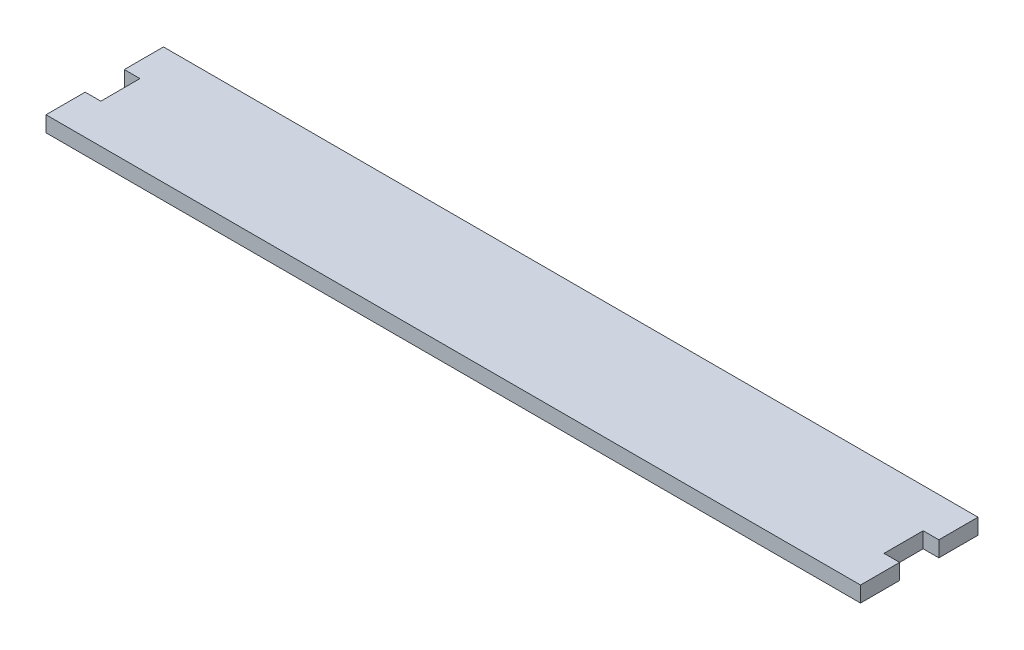
from build123d import *

# Parameters (mm, degrees)
BOSS_EXTRUDE2_DEPTH = 4


with BuildPart() as part:
    # Sketch1 → Boss-Extrude2 (new body)
    with BuildSketch(Plane(origin=(0, 0, 0), x_dir=(1, 0, 0), z_dir=(0, 1, 0))):
        Polygon((204, 30), (204, 20), (200, 20), (200, 10), (204, 10), (204, 0), (200, 0), (0, 0), (-4, 0), (-4, 10), (0, 10), (0, 20), (-4, 20), (-4, 30), (0, 30), (200, 30), align=None)
    extrude(amount=BOSS_EXTRUDE2_DEPTH)


solid = part.part
